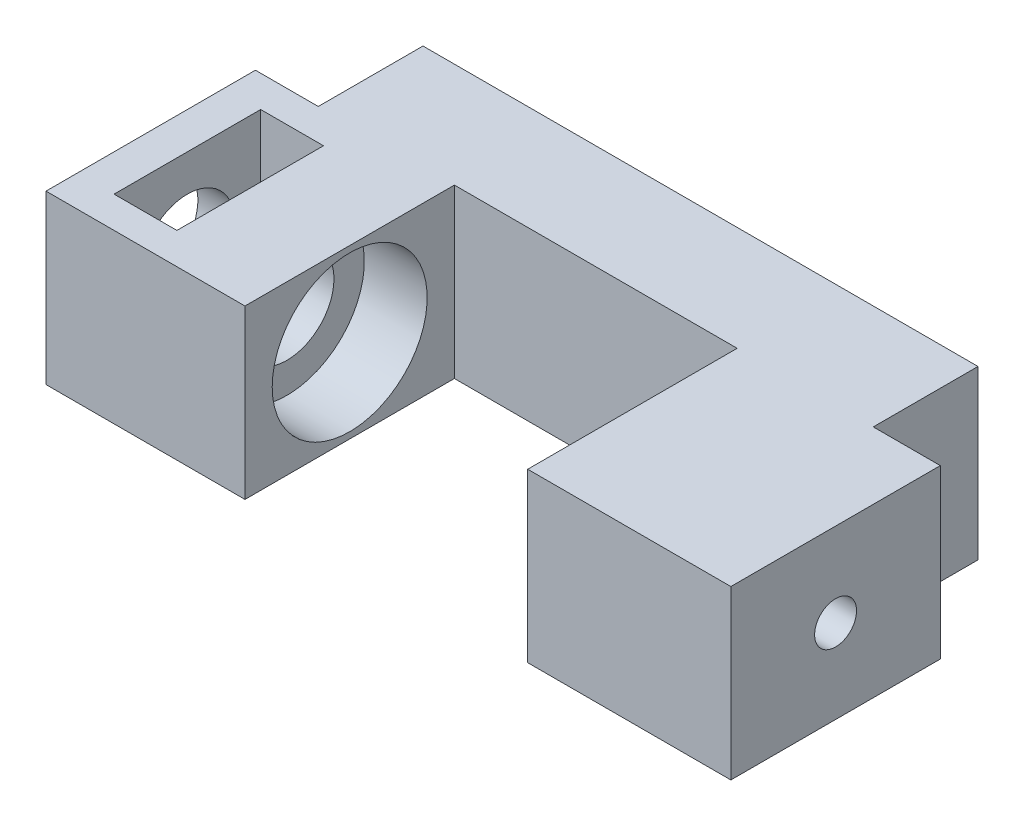
from build123d import *

# Parameters (mm, degrees)
SHAPE_DEPTH                   = 4
SHAPE_DEPTH_BACK              = 4
ESQUISSE19_R                  = 2.25
HOLEAXE_MOTOR_DEPTH           = 13
ESQUISSE20_R                  = 3.7
HOLEBEARING_MOTOR_DEPTH       = 3
ESQUISSE21_R                  = 2.2
ENTRETOISEBEARING_MOTOR_DEPTH = 1
EXT_MOTOR_START               = 3
ESQUISSE22_W                  = 10
ESQUISSE22_H                  = 8
ESQUISSE22_R                  = 2.25
EXT_MOTOR_DEPTH               = 3
ESQUISSE23_W                  = 3
ESQUISSE23_H                  = 7
HOLESCREWLESS_MOTOR_DEPTH     = 10
ESQUISSE24_W                  = 10
ESQUISSE24_H                  = 8
BOSS_EXTRU_1_DEPTH            = 3.2
ESQUISSE25_R                  = 1
REMOVE_HELPER_DEPTH           = 10


with BuildPart() as part:
    # Esquisse17 → Shape (new, two sides: drawn at the far end of the back side and taken through both)
    with BuildSketch(Plane(origin=(0, 40, 0), x_dir=(-1, 0, 0), z_dir=(0, -1, 0)).offset(-SHAPE_DEPTH_BACK)):
        Polygon((13.25, 105), (13.25, 95), (6.75, 95), (6.75, 105), (-6.75, 105), (-6.75, 95), (-13.25, 95), (-13.25, 105), (-13.25, 110), (13.25, 110), align=None)
    extrude(amount=SHAPE_DEPTH + SHAPE_DEPTH_BACK)

    # Esquisse19 → HoleAxe_motor (cut)
    with BuildSketch(Plane.ZY.offset(13.25)):
        with Locations((-100, 40)):
            Circle(ESQUISSE19_R)
    extrude(amount=-HOLEAXE_MOTOR_DEPTH, mode=Mode.SUBTRACT)

    # Esquisse20 → HoleBearing_motor (cut)
    with BuildSketch(Plane.ZY.offset(-6.75)):
        with Locations((-100, 40)):
            Circle(ESQUISSE20_R)
    holebearing_motor = extrude(amount=-HOLEBEARING_MOTOR_DEPTH, mode=Mode.SUBTRACT)

    # Symétrie3: HoleBearing_motor across plane
    add(holebearing_motor.mirror(Plane(origin=(0, 0, 0), x_dir=(0, 0, 1), z_dir=(1, 0, 0))), mode=Mode.SUBTRACT)

    # Esquisse21 → entretoiseBearing_motor (cut)
    with BuildSketch(Plane.ZY.offset(-9.75)):
        with Locations((-100, 40)):
            Circle(ESQUISSE21_R)
    extrude(amount=-ENTRETOISEBEARING_MOTOR_DEPTH, mode=Mode.SUBTRACT)

    # Esquisse22 → Ext_motor (add)
    with BuildSketch(Plane.ZY.offset(13.25).offset(EXT_MOTOR_START)):
        with Locations((-100, 40)):
            Rectangle(ESQUISSE22_W, ESQUISSE22_H)
        with Locations((-100, 40)):
            Circle(ESQUISSE22_R, mode=Mode.SUBTRACT)
    extrude(amount=-EXT_MOTOR_DEPTH)

    # Esquisse23 → HoleScrewLess_motor (cut)
    with BuildSketch(Plane(origin=(0, 44, 0), x_dir=(1, 0, 0), z_dir=(0, 1, 0))):
        with Locations((-13, 100)):
            Rectangle(ESQUISSE23_W, ESQUISSE23_H)
    extrude(amount=-HOLESCREWLESS_MOTOR_DEPTH, mode=Mode.SUBTRACT)

    # Esquisse24 → Boss.-Extru.1 (add)
    with BuildSketch(Plane(origin=(13.25, 0, 0), x_dir=(0, 0, -1), z_dir=(1, 0, 0))):
        with Locations((100, 40)):
            Rectangle(ESQUISSE24_W, ESQUISSE24_H)
    extrude(amount=BOSS_EXTRU_1_DEPTH)

    # Esquisse25 → Remove helper (cut)
    with BuildSketch(Plane.ZY.offset(-10.75)):
        with Locations((-100, 40)):
            Circle(ESQUISSE25_R)
    extrude(amount=-REMOVE_HELPER_DEPTH, mode=Mode.SUBTRACT)


solid = part.part
